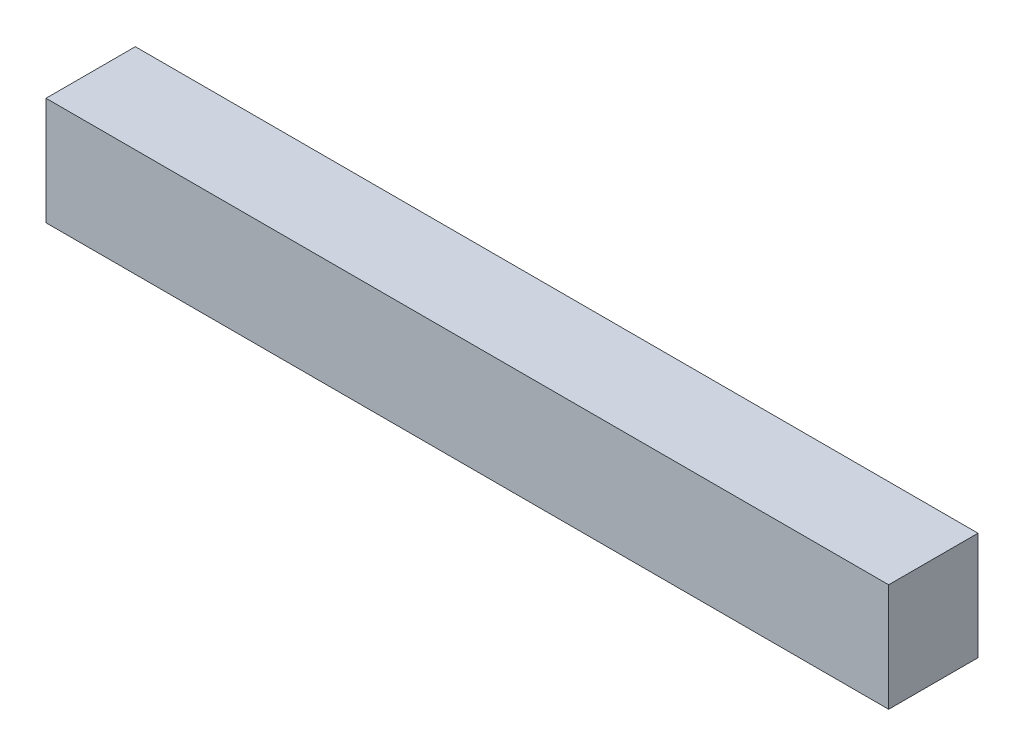
from build123d import *

# Parameters (mm, degrees)
SKETCH1_W           = 30
SKETCH1_H           = 3.84
BOSS_EXTRUDE1_DEPTH = 3.18


with BuildPart() as part:
    # Sketch1 → Boss-Extrude1 (new body)
    with BuildSketch(Plane.XY):
        with Locations((15, 1.92)):
            Rectangle(SKETCH1_W, SKETCH1_H)
    extrude(amount=BOSS_EXTRUDE1_DEPTH)


solid = part.part
